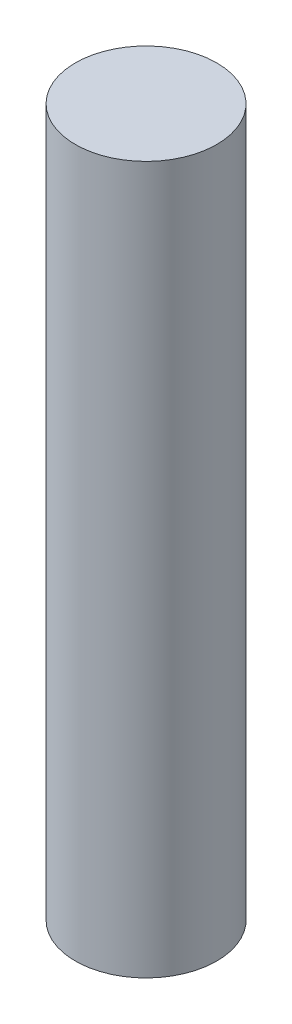
from build123d import *

# Parameters (mm, degrees)
SKETCH1_W = 25.4
SKETCH1_H = 254


with BuildPart() as part:
    # Sketch1 → Revolve1 (revolve)
    with BuildSketch(Plane.XY, mode=Mode.PRIVATE) as revolve1_sk:
        with Locations((12.7, 127.47973101)):
            Rectangle(SKETCH1_W, SKETCH1_H)
    revolve(revolve1_sk.sketch.rotate(Axis((0, 0.47973101, 0), (0, 1, 0)), 90), axis=Axis((0, 0.47973101, 0), (0, 1, 0)))


solid = part.part
